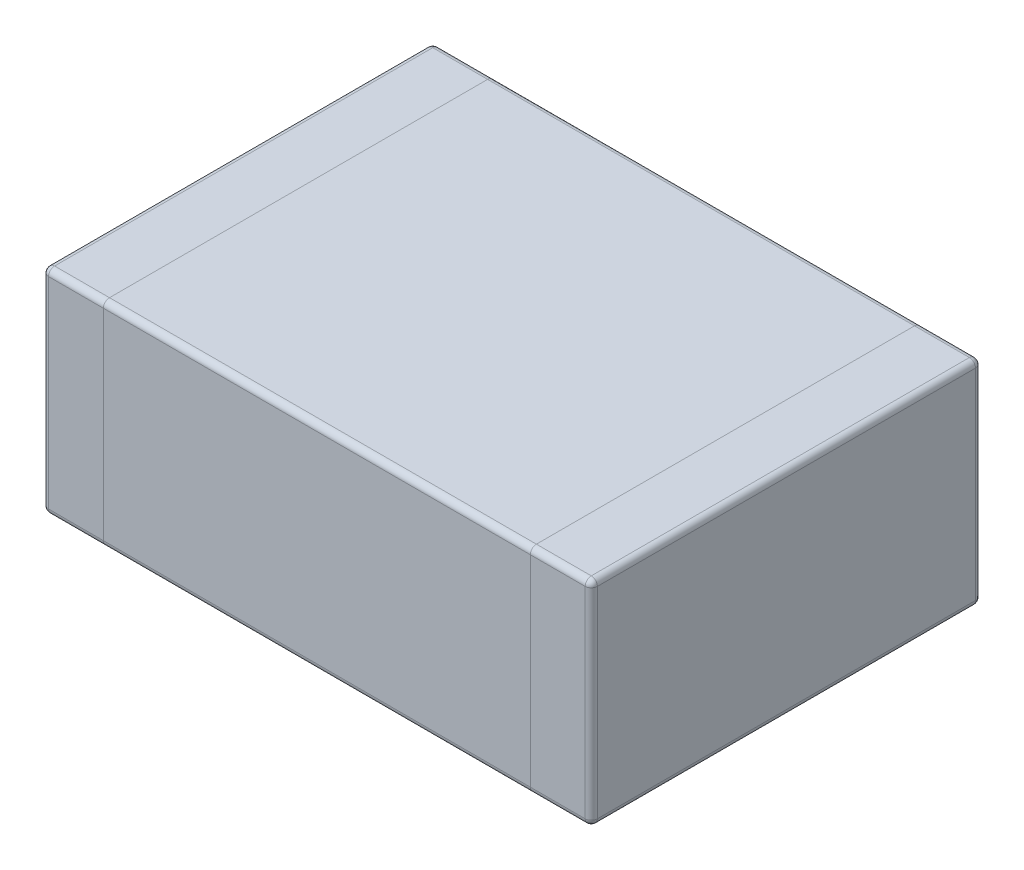
from build123d import *

# Parameters (mm, degrees)
SKETCH1_W      = 4.5
SKETCH1_H      = 3.2
EXTRUDE1_DEPTH = 1.75
FILLET1_R      = 0.05


with BuildPart() as part:
    # Sketch1 → Extrude1 (new body)
    with BuildSketch(Plane(origin=(0, 0, 0), x_dir=(1, 0, 0), z_dir=(0, 1, 0))):
        Rectangle(SKETCH1_W, SKETCH1_H)
    extrude(amount=EXTRUDE1_DEPTH)

    # Fillet1
    fillet1_edges = [part.edges().sort_by_distance(p)[0] for p in [
        (-2.25, 1.75, 0),
        (0, 1.75, 1.6),
        (2.25, 1.75, 0),
        (0, 0, 1.6),
        (-2.25, 0, 0),
        (0, 0, -1.6),
        (2.25, 0, 0),
        (0, 1.75, -1.6),
        (2.25, 0.875, 1.6),
        (-2.25, 0.875, 1.6),
        (-2.25, 0.875, -1.6),
        (2.25, 0.875, -1.6),
    ]]
    fillet(fillet1_edges, radius=FILLET1_R)


solid = part.part
